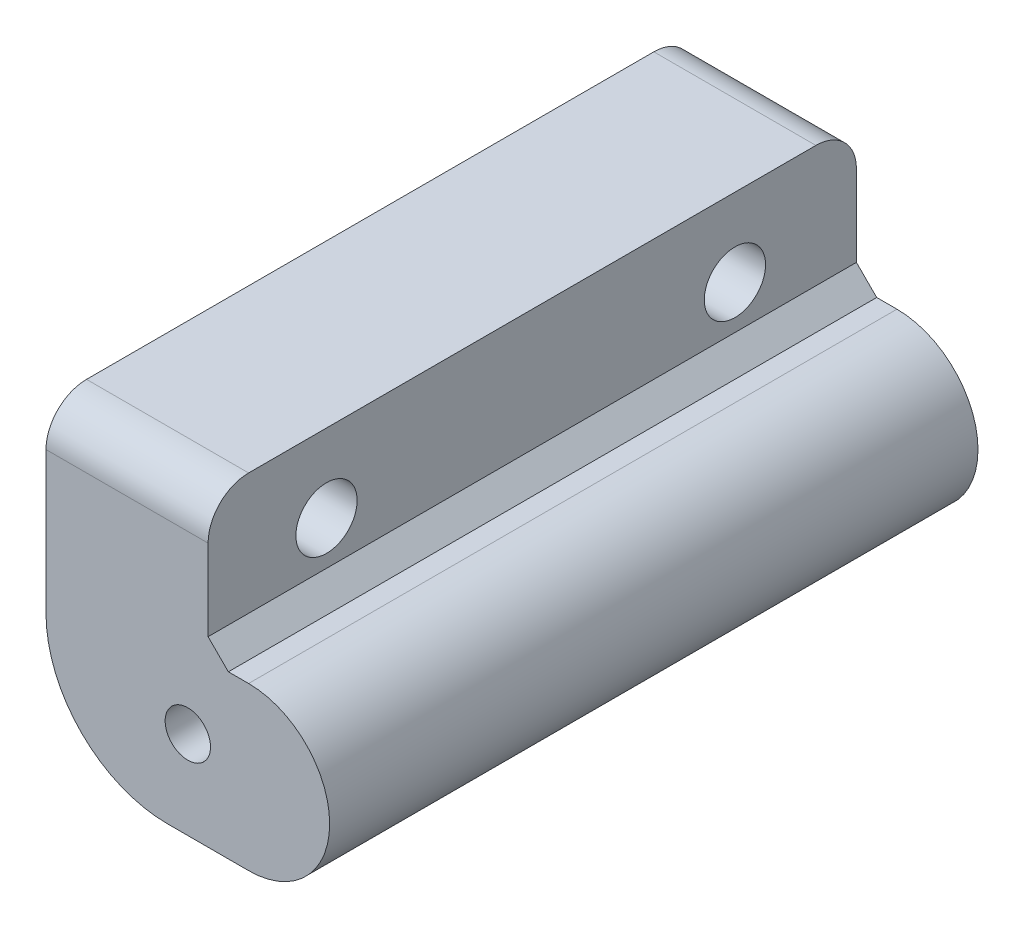
from build123d import *

# Parameters (mm, degrees)
BOSS_EXTRUDE1_DEPTH  = 25.4
CHAMFER1_SIZE        = 0.79375
SKETCH2_R            = 0.889
CUT_EXTRUDE1_DEPTH   = 27.940768363
M2_CLEARANCE_HOLE1_D = 2.4
FILLET1_RADIUS       = 3.175
FILLET1_LENGTH       = 25.4
FILLET2_R            = 4.7625
FILLET3_R            = 1.5875


with BuildPart() as part:
    # Sketch1 → Boss-Extrude1 (new body)
    with BuildSketch(Plane.XY):
        Polygon((0, 0), (0, 5.55625), (-6.35, 5.55625), (-6.35, -6.35), (4.7625, -6.35), (4.7625, 0), align=None)
    extrude(amount=BOSS_EXTRUDE1_DEPTH)

    # Chamfer1
    chamfer1_edges = [part.edges().sort_by_distance(p)[0] for p in [
        (0, 0, 12.7),
    ]]
    chamfer(chamfer1_edges, length=CHAMFER1_SIZE)

    # Sketch2 → Cut-Extrude1 (cut, through all)
    with BuildSketch(Plane.XY.offset(25.4)):
        with Locations((-0.79375, -2.90315)):
            Circle(SKETCH2_R)
    extrude(amount=-CUT_EXTRUDE1_DEPTH, mode=Mode.SUBTRACT)

    # M2 Clearance Hole1 (through all)
    with Locations(Plane(origin=(0, 0, 0), x_dir=(0, 0, -1), z_dir=(1, 0, 0))):
        with Locations((-20.7609375, 2.5), (-4.7609375, 2.5)):
            Hole(M2_CLEARANCE_HOLE1_D / 2)

    # Fillet1: full round fillet: the end face becomes a half cylinder, R = half its width
    fillet1_face = Plane((4.7625, -3.175, 12.7), x_dir=(0, 0, 1), z_dir=(1, 0, 0))  # on the end face: x along it, z out of the body
    fillet1_slab = fillet1_face.offset(-FILLET1_RADIUS / 2) * Box(FILLET1_LENGTH, 2 * FILLET1_RADIUS, FILLET1_RADIUS, mode=Mode.PRIVATE)  # the body's end, R deep
    fillet1_round = Plane((1.5875, -3.175, 12.7), x_dir=(1, 0, 0), z_dir=(0, 0, 1)) * Cylinder(FILLET1_RADIUS, FILLET1_LENGTH, mode=Mode.PRIVATE)  # its axis R under the face
    add(fillet1_slab - fillet1_round, mode=Mode.SUBTRACT)

    # Fillet2
    fillet2_edges = [part.edges().sort_by_distance(p)[0] for p in [
        (-6.35, -6.35, 12.7),
    ]]
    fillet(fillet2_edges, radius=FILLET2_R)

    # Fillet3
    fillet3_edges = [part.edges().sort_by_distance(p)[0] for p in [
        (-3.175, 5.55625, 25.4),
        (-3.175, 5.55625, 0),
    ]]
    fillet(fillet3_edges, radius=FILLET3_R)


solid = part.part
